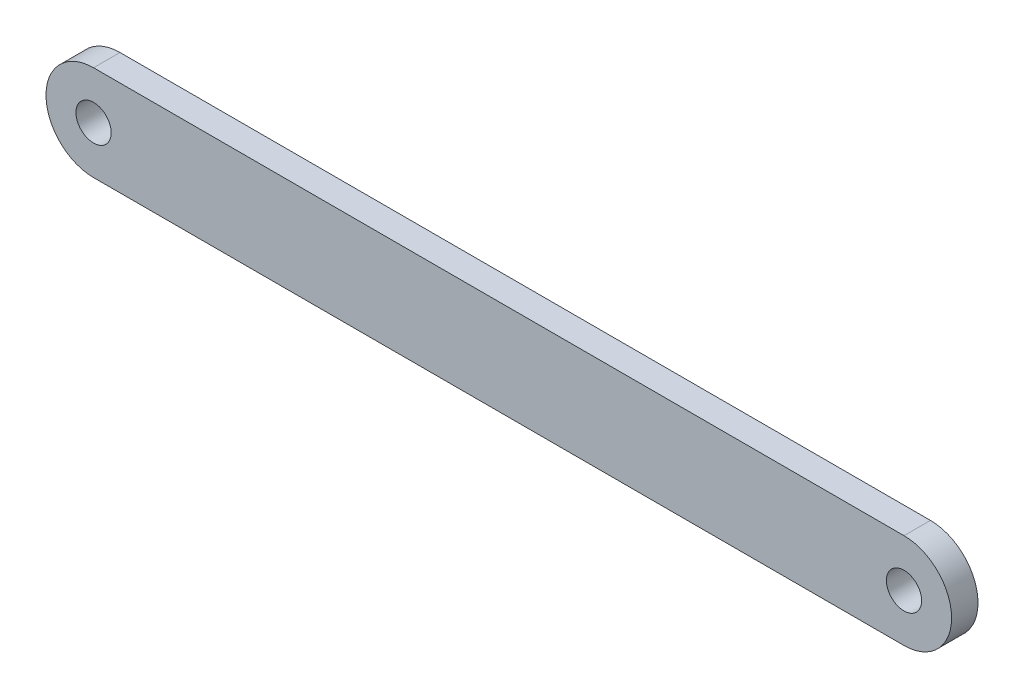
from build123d import *

# Parameters (mm, degrees)
SKETCH2_R           = 10
BOSS_EXTRUDE2_DEPTH = 15


with BuildPart() as part:
    # Sketch2 → Boss-Extrude2 (new body)
    with BuildSketch(Plane.XY):
        with BuildLine():
            Line((-230, 27), (230, 27))
            ThreePointArc((230, 27), (257, 0), (230, -27))
            Line((230, -27), (-230, -27))
            ThreePointArc((-230, -27), (-257, 0), (-230, 27))
        make_face()
        with Locations((-230, 0)):
            Circle(SKETCH2_R, mode=Mode.SUBTRACT)
        with Locations(Location((230, 0, 0), (0, 0, 180))):
            Circle(SKETCH2_R, mode=Mode.SUBTRACT)
    extrude(amount=-BOSS_EXTRUDE2_DEPTH)


solid = part.part
